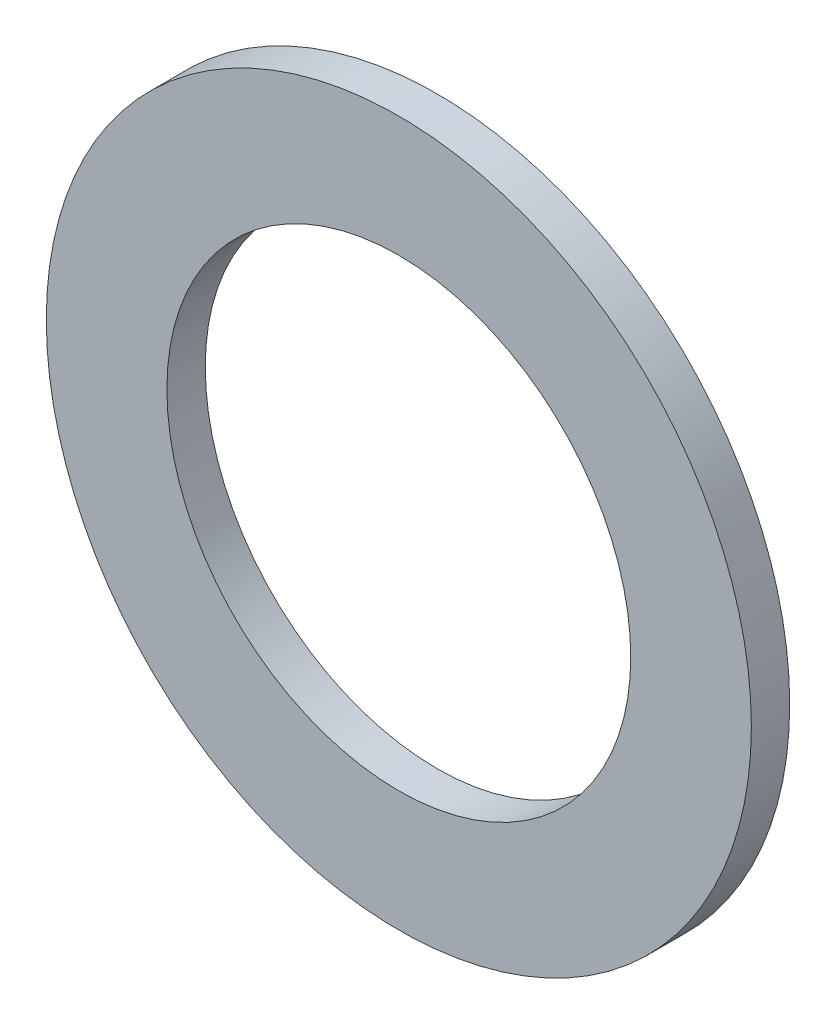
from build123d import *

# Parameters (mm, degrees)
SKETCH3_R           = 7.239
SKETCH3_R_2         = 4.7625
BOSS_EXTRUDE1_DEPTH = 0.3937


with BuildPart() as part:
    # Sketch3 → Boss-Extrude1 (new, symmetric)
    with BuildSketch(Plane.XY):
        Circle(SKETCH3_R)
        Circle(SKETCH3_R_2, mode=Mode.SUBTRACT)
    extrude(amount=BOSS_EXTRUDE1_DEPTH, both=True)


solid = part.part
